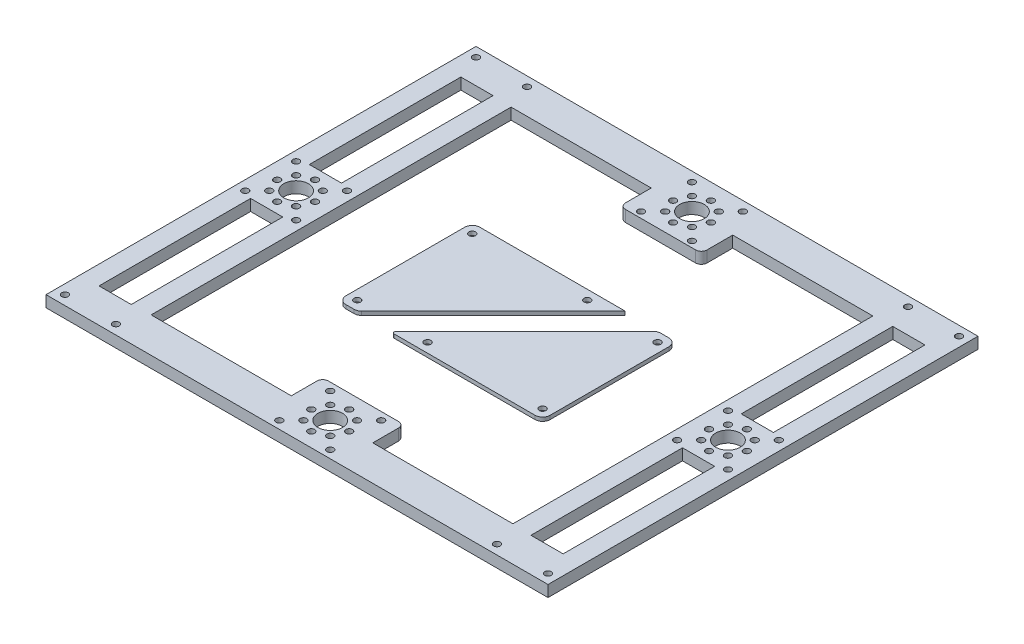
from build123d import *

# Parameters (mm, degrees)
ESQUISSE1_W             = 265
ESQUISSE1_H             = 227
ESQUISSE1_R             = 6.5
ESQUISSE1_R_2           = 1.75
ESQUISSE1_R_3           = 1.749999999
ESQUISSE1_W_2           = 191
ESQUISSE1_H_2           = 156.859849262
ESQUISSE1_W_3           = 17
ESQUISSE1_H_3           = 80
BOSS_EXTRU_1_DEPTH      = 6
ESQUISSE2_W             = 73.988395344
ESQUISSE2_H             = 16.570075369
ENL_V_MAT_EXTRU_1_DEPTH = 10
CONG_1_R                = 3
ESQUISSE3_R             = 1.75
BOSS_EXTRU_2_DEPTH      = 2
BOSS_EXTRU_2_2_DEPTH    = 2
CONG_2_R                = 4
CONG_3_R                = 4
CONG_4_R                = 1


with BuildPart() as part:
    # Esquisse1 → Boss.-Extru.1 (new body)
    with BuildSketch(Plane(origin=(0, 0, 0), x_dir=(1, 0, 0), z_dir=(0, 1, 0))):
        with Locations((132.5, -113.5)):
            Rectangle(ESQUISSE1_W, ESQUISSE1_H)
        with Locations(Location((246.5, -113.5, 0), (0, 0, 270))):
            Circle(ESQUISSE1_R, mode=Mode.SUBTRACT)
        with Locations(Location((246.5, -103.5, 0), (0, 0, 270))):
            Circle(ESQUISSE1_R_2, mode=Mode.SUBTRACT)
        with Locations(Location((253.571068024, -106.4289324, 0), (0, 0, 270))):
            Circle(ESQUISSE1_R_2, mode=Mode.SUBTRACT)
        with Locations(Location((256.5, -113.5, 0), (0, 0, 270))):
            Circle(ESQUISSE1_R_2, mode=Mode.SUBTRACT)
        with Locations(Location((253.571067812, -120.571067812, 0), (0, 0, 270))):
            Circle(ESQUISSE1_R_2, mode=Mode.SUBTRACT)
        with Locations(Location((246.5, -123.5, 0), (0, 0, 270))):
            Circle(ESQUISSE1_R_2, mode=Mode.SUBTRACT)
        with Locations(Location((239.428932188, -120.571067812, 0), (0, 0, 270))):
            Circle(ESQUISSE1_R_2, mode=Mode.SUBTRACT)
        with Locations(Location((236.5, -113.5, 0), (0, 0, 270))):
            Circle(ESQUISSE1_R_2, mode=Mode.SUBTRACT)
        with Locations(Location((239.42893238, -106.428931957, 0), (0, 0, 270))):
            Circle(ESQUISSE1_R_3, mode=Mode.SUBTRACT)
        with Locations(Location((259.935029054, -100.064971369, 0), (0, 0, 270))):
            Circle(ESQUISSE1_R_2, mode=Mode.SUBTRACT)
        with Locations(Location((259.935028843, -126.935028843, 0), (0, 0, 270))):
            Circle(ESQUISSE1_R_2, mode=Mode.SUBTRACT)
        with Locations(Location((233.064971369, -100.064970946, 0), (0, 0, 270))):
            Circle(ESQUISSE1_R_2, mode=Mode.SUBTRACT)
        with Locations(Location((233.064971157, -126.935028843, 0), (0, 0, 270))):
            Circle(ESQUISSE1_R_2, mode=Mode.SUBTRACT)
        with Locations(Location((132.5, -209.464962315, 0), (0, 0, 270))):
            Circle(ESQUISSE1_R, mode=Mode.SUBTRACT)
        with Locations(Location((132.5, -199.464962315, 0), (0, 0, 270))):
            Circle(ESQUISSE1_R_2, mode=Mode.SUBTRACT)
        with Locations(Location((139.571068024, -202.393894715, 0), (0, 0, 270))):
            Circle(ESQUISSE1_R_2, mode=Mode.SUBTRACT)
        with Locations(Location((142.5, -209.464962315, 0), (0, 0, 270))):
            Circle(ESQUISSE1_R_2, mode=Mode.SUBTRACT)
        with Locations(Location((139.571067812, -216.536030127, 0), (0, 0, 270))):
            Circle(ESQUISSE1_R_2, mode=Mode.SUBTRACT)
        with Locations(Location((132.5, -219.464962315, 0), (0, 0, 270))):
            Circle(ESQUISSE1_R_2, mode=Mode.SUBTRACT)
        with Locations(Location((125.428932188, -216.536030127, 0), (0, 0, 270))):
            Circle(ESQUISSE1_R_2, mode=Mode.SUBTRACT)
        with Locations(Location((122.5, -209.464962315, 0), (0, 0, 270))):
            Circle(ESQUISSE1_R_2, mode=Mode.SUBTRACT)
        with Locations(Location((125.42893238, -202.393894272, 0), (0, 0, 270))):
            Circle(ESQUISSE1_R_3, mode=Mode.SUBTRACT)
        with Locations(Location((145.935029054, -196.029933685, 0), (0, 0, 270))):
            Circle(ESQUISSE1_R_2, mode=Mode.SUBTRACT)
        with Locations(Location((145.935028843, -222.899991158, 0), (0, 0, 270))):
            Circle(ESQUISSE1_R_2, mode=Mode.SUBTRACT)
        with Locations(Location((119.064971369, -196.029933261, 0), (0, 0, 270))):
            Circle(ESQUISSE1_R_2, mode=Mode.SUBTRACT)
        with Locations(Location((119.064971157, -222.899991158, 0), (0, 0, 270))):
            Circle(ESQUISSE1_R_2, mode=Mode.SUBTRACT)
        with Locations(Location((18.513965978, -113.5, 0), (0, 0, 270))):
            Circle(ESQUISSE1_R, mode=Mode.SUBTRACT)
        with Locations(Location((18.513965978, -103.5, 0), (0, 0, 270))):
            Circle(ESQUISSE1_R_2, mode=Mode.SUBTRACT)
        with Locations(Location((25.585034002, -106.4289324, 0), (0, 0, 270))):
            Circle(ESQUISSE1_R_2, mode=Mode.SUBTRACT)
        with Locations(Location((28.513965978, -113.5, 0), (0, 0, 270))):
            Circle(ESQUISSE1_R_2, mode=Mode.SUBTRACT)
        with Locations(Location((25.58503379, -120.571067812, 0), (0, 0, 270))):
            Circle(ESQUISSE1_R_2, mode=Mode.SUBTRACT)
        with Locations(Location((18.513965978, -123.5, 0), (0, 0, 270))):
            Circle(ESQUISSE1_R_2, mode=Mode.SUBTRACT)
        with Locations(Location((11.442898166, -120.571067812, 0), (0, 0, 270))):
            Circle(ESQUISSE1_R_2, mode=Mode.SUBTRACT)
        with Locations(Location((8.513965978, -113.5, 0), (0, 0, 270))):
            Circle(ESQUISSE1_R_2, mode=Mode.SUBTRACT)
        with Locations(Location((11.442898358, -106.428931957, 0), (0, 0, 270))):
            Circle(ESQUISSE1_R_3, mode=Mode.SUBTRACT)
        with Locations(Location((31.948995033, -100.064971369, 0), (0, 0, 270))):
            Circle(ESQUISSE1_R_2, mode=Mode.SUBTRACT)
        with Locations(Location((31.948994821, -126.935028843, 0), (0, 0, 270))):
            Circle(ESQUISSE1_R_2, mode=Mode.SUBTRACT)
        with Locations(Location((5.078937347, -100.064970946, 0), (0, 0, 270))):
            Circle(ESQUISSE1_R_2, mode=Mode.SUBTRACT)
        with Locations(Location((5.078937136, -126.935028843, 0), (0, 0, 270))):
            Circle(ESQUISSE1_R_2, mode=Mode.SUBTRACT)
        with Locations(Location((132.5, -18.5, 0), (0, 0, 270))):
            Circle(ESQUISSE1_R, mode=Mode.SUBTRACT)
        with Locations(Location((132.5, -8.5, 0), (0, 0, 270))):
            Circle(ESQUISSE1_R_2, mode=Mode.SUBTRACT)
        with Locations(Location((139.571068024, -11.4289324, 0), (0, 0, 270))):
            Circle(ESQUISSE1_R_2, mode=Mode.SUBTRACT)
        with Locations(Location((142.5, -18.5, 0), (0, 0, 270))):
            Circle(ESQUISSE1_R_2, mode=Mode.SUBTRACT)
        with Locations(Location((139.571067812, -25.571067812, 0), (0, 0, 270))):
            Circle(ESQUISSE1_R_2, mode=Mode.SUBTRACT)
        with Locations(Location((132.5, -28.5, 0), (0, 0, 270))):
            Circle(ESQUISSE1_R_2, mode=Mode.SUBTRACT)
        with Locations(Location((125.428932188, -25.571067812, 0), (0, 0, 270))):
            Circle(ESQUISSE1_R_2, mode=Mode.SUBTRACT)
        with Locations(Location((122.5, -18.5, 0), (0, 0, 270))):
            Circle(ESQUISSE1_R_2, mode=Mode.SUBTRACT)
        with Locations(Location((125.42893238, -11.428931957, 0), (0, 0, 270))):
            Circle(ESQUISSE1_R_3, mode=Mode.SUBTRACT)
        with Locations(Location((145.935029054, -5.064971369, 0), (0, 0, 270))):
            Circle(ESQUISSE1_R_2, mode=Mode.SUBTRACT)
        with Locations(Location((145.935028843, -31.935028843, 0), (0, 0, 270))):
            Circle(ESQUISSE1_R_2, mode=Mode.SUBTRACT)
        with Locations(Location((119.064971369, -5.064970946, 0), (0, 0, 270))):
            Circle(ESQUISSE1_R_2, mode=Mode.SUBTRACT)
        with Locations(Location((119.064971157, -31.935028843, 0), (0, 0, 270))):
            Circle(ESQUISSE1_R_2, mode=Mode.SUBTRACT)
        with Locations(Location((260, -5, 0), (0, 0, 270))):
            Circle(ESQUISSE1_R_2, mode=Mode.SUBTRACT)
        with Locations(Location((233.064971369, -5, 0), (0, 0, 270))):
            Circle(ESQUISSE1_R_2, mode=Mode.SUBTRACT)
        with Locations(Location((260, -222, 0), (0, 0, 90))):
            Circle(ESQUISSE1_R_2, mode=Mode.SUBTRACT)
        with Locations(Location((233.064971369, -222, 0), (0, 0, 90))):
            Circle(ESQUISSE1_R_2, mode=Mode.SUBTRACT)
        with Locations(Location((5, -5, 0), (0, 0, 90))):
            Circle(ESQUISSE1_R_2, mode=Mode.SUBTRACT)
        with Locations(Location((31.935028631, -5, 0), (0, 0, 90))):
            Circle(ESQUISSE1_R_2, mode=Mode.SUBTRACT)
        with Locations(Location((5, -222, 0), (0, 0, 270))):
            Circle(ESQUISSE1_R_2, mode=Mode.SUBTRACT)
        with Locations(Location((31.935028631, -222, 0), (0, 0, 270))):
            Circle(ESQUISSE1_R_2, mode=Mode.SUBTRACT)
        with Locations((132.5, -113.5)):
            Rectangle(ESQUISSE1_W_2, ESQUISSE1_H_2, mode=Mode.SUBTRACT)
        with Locations((246.5, -58)):
            Rectangle(ESQUISSE1_W_3, ESQUISSE1_H_3, mode=Mode.SUBTRACT)
        with Locations((246.5, -169)):
            Rectangle(ESQUISSE1_W_3, ESQUISSE1_H_3, mode=Mode.SUBTRACT)
        with Locations((18.5, -58)):
            Rectangle(ESQUISSE1_W_3, ESQUISSE1_H_3, mode=Mode.SUBTRACT)
        with Locations((18.5, -169)):
            Rectangle(ESQUISSE1_W_3, ESQUISSE1_H_3, mode=Mode.SUBTRACT)
    extrude(amount=BOSS_EXTRU_1_DEPTH)

    # Esquisse2 → Enlèv. mat.-Extru.1 (cut)
    with BuildSketch(Plane(origin=(0, 6, 0), x_dir=(1, 0, 0), z_dir=(0, 1, 0))):
        with Locations((73.994197672, -26.785037685)):
            Rectangle(ESQUISSE2_W, ESQUISSE2_H)
        with Locations((191.005802328, -26.785037685)):
            Rectangle(ESQUISSE2_W, ESQUISSE2_H)
        with Locations((191.005802328, -200.214962316)):
            Rectangle(ESQUISSE2_W, ESQUISSE2_H)
        with Locations((73.994197672, -200.214962316)):
            Rectangle(ESQUISSE2_W, ESQUISSE2_H)
    extrude(amount=-ENL_V_MAT_EXTRU_1_DEPTH, mode=Mode.SUBTRACT)

    # Congé1
    cong_1_edges = [part.edges().sort_by_distance(p)[0] for p in [
        (110.988395344, 3, 35.070075369),
        (154.011604656, 3, 35.070075369),
        (110.988395344, 3, 191.929924631),
        (154.011604656, 3, 191.929924631),
    ]]
    fillet(cong_1_edges, radius=CONG_1_R)


with BuildPart() as body_2:
    # Esquisse3 → Boss.-Extru.2 (new body)
    with BuildSketch(Plane.XZ):
        Polygon((75.678818623, 77.655465357), (75.678818623, 148.366143475), (85.678818623, 148.366143475), (156.389496742, 77.655465357), align=None)
        with Locations(Location((80.678818623, 82.655465357, 0), (0, 0, 270))):
            Circle(ESQUISSE3_R, mode=Mode.SUBTRACT)
        with Locations(Location((141.389496742, 82.655465357, 0), (0, 0, 270))):
            Circle(ESQUISSE3_R, mode=Mode.SUBTRACT)
        with Locations(Location((80.678818623, 143.366143476, 0), (0, 0, 270))):
            Circle(ESQUISSE3_R, mode=Mode.SUBTRACT)
    extrude(amount=-BOSS_EXTRU_2_DEPTH)

    # Congé2
    cong_2_edges = [body_2.edges().sort_by_distance(p)[0] for p in [
        (75.678818623, 1, 148.366143475),
        (85.678818623, 1, 148.366143475),
        (75.678818623, 1, 77.655465357),
    ]]
    fillet(cong_2_edges, radius=CONG_2_R)


with BuildPart() as body_3:
    # Esquisse3 → Boss.-Extru.2 2 (new body)
    with BuildSketch(Plane.XZ):
        Polygon((184.195937966, 149.04990607), (184.195937966, 78.339227951), (174.195937966, 78.339227951), (103.485259847, 149.04990607), align=None)
        with Locations(Location((179.195937966, 144.04990607, 0), (0, 0, 270))):
            Circle(ESQUISSE3_R, mode=Mode.SUBTRACT)
        with Locations(Location((118.485259847, 144.04990607, 0), (0, 0, 270))):
            Circle(ESQUISSE3_R, mode=Mode.SUBTRACT)
        with Locations(Location((179.195937966, 83.33922795, 0), (0, 0, 270))):
            Circle(ESQUISSE3_R, mode=Mode.SUBTRACT)
    extrude(amount=-BOSS_EXTRU_2_2_DEPTH)

    # Congé3
    cong_3_edges = [body_3.edges().sort_by_distance(p)[0] for p in [
        (184.195937966, 1, 78.339227951),
        (174.195937966, 1, 78.339227951),
        (184.195937966, 1, 149.04990607),
    ]]
    fillet(cong_3_edges, radius=CONG_3_R)

    # Congé4
    cong_4_edges = [body_3.edges().sort_by_distance(p)[0] for p in [
        (103.485259847, 1, 149.04990607),
    ]]
    fillet(cong_4_edges, radius=CONG_4_R)


solid = Compound([part.part, body_2.part, body_3.part])
